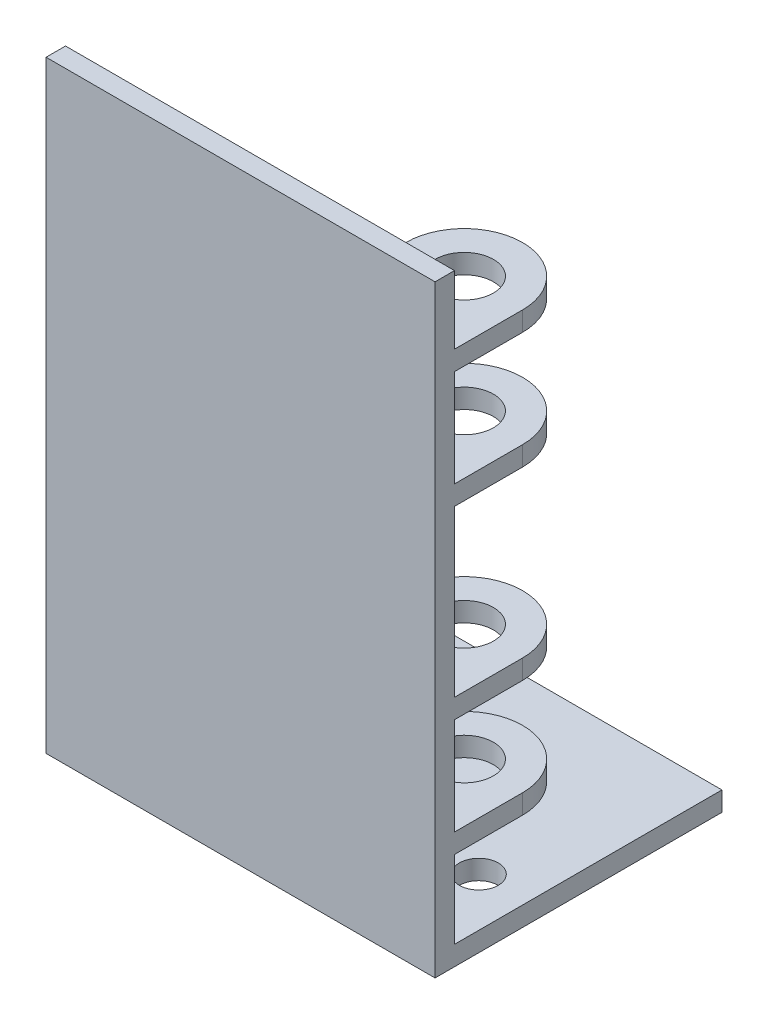
from build123d import *

# Parameters (mm, degrees)
CROQUIS2_W               = 40
CROQUIS2_H               = 55
CROQUIS2_R               = 2
SALIENTE_EXTRUIR1_DEPTH  = 2
CROQUIS3_W               = 40
CROQUIS3_H               = 2
SALIENTE_EXTRUIR2_DEPTH  = 42
CROQUIS4_R               = 3
SALIENTE_EXTRUIR3_DEPTH  = 2
MATRIZL1_COUNT           = 2
MATRIZL1_PITCH           = 12
CROQUIS6_W               = 40
CROQUIS6_H               = 27.5
CORTAR_EXTRUIR1_DEPTH    = 79.89866919
CROQUIS7_W               = 40
CROQUIS7_H               = 2
SALIENTE_EXTRUIR5_DEPTH  = 20
MATRIZL2_COPY_1_SKETCH_R = 3
MATRIZL2_COPY_1_DEPTH    = 2
MATRIZL2_COPY_2_SKETCH_R = 3
MATRIZL2_COPY_2_DEPTH    = 2


with BuildPart() as part:
    # Croquis2 → Saliente-Extruir1 (new body)
    with BuildSketch(Plane(origin=(0, 0, 0), x_dir=(1, 0, 0), z_dir=(0, 1, 0))):
        with Locations((20, 27.5)):
            Rectangle(CROQUIS2_W, CROQUIS2_H)
        with Locations(Location((5, 47.5, 0), (0, 0, 270))):
            Circle(CROQUIS2_R, mode=Mode.SUBTRACT)
        with Locations(Location((35, 47.5, 0), (0, 0, 270))):
            Circle(CROQUIS2_R, mode=Mode.SUBTRACT)
        with Locations(Location((35, 7.5, 0), (0, 0, 270))):
            Circle(CROQUIS2_R, mode=Mode.SUBTRACT)
        with Locations(Location((5, 7.5, 0), (0, 0, 270))):
            Circle(CROQUIS2_R, mode=Mode.SUBTRACT)
    extrude(amount=SALIENTE_EXTRUIR1_DEPTH)

    # Croquis3 → Saliente-Extruir2 (add)
    with BuildSketch(Plane(origin=(0, 0, 0), x_dir=(1, 0, 0), z_dir=(0, 1, 0))):
        with Locations((20, -1)):
            Rectangle(CROQUIS3_W, CROQUIS3_H)
    extrude(amount=SALIENTE_EXTRUIR2_DEPTH)

    # Croquis4 → Saliente-Extruir3 (add)
    with BuildSketch(Plane(origin=(0, 22, 0), x_dir=(1, 0, 0), z_dir=(0, 1, 0))):
        with BuildLine():
            Line((40, 7), (40, 0))
            Line((40, 0), (28, 0))
            Line((28, 0), (28, 7))
            ThreePointArc((28, 7), (34, 13), (40, 7))
        make_face()
        with Locations(Location((34, 7, 0), (0, 0, 270))):
            Circle(CROQUIS4_R, mode=Mode.SUBTRACT)
    saliente_extruir3 = extrude(amount=SALIENTE_EXTRUIR3_DEPTH)

    # MatrizL1: Saliente-Extruir3 ×2
    with Locations(*[(0, -i * MATRIZL1_PITCH, 0) for i in range(1, MATRIZL1_COUNT)]):
        add(saliente_extruir3)

    # Croquis6 → Cortar-Extruir1 (cut, through all)
    with BuildSketch(Plane(origin=(0, 2, 0), x_dir=(1, 0, 0), z_dir=(0, 1, 0))):
        with Locations((20, 41.25)):
            Rectangle(CROQUIS6_W, CROQUIS6_H)
    extrude(amount=-CORTAR_EXTRUIR1_DEPTH, mode=Mode.SUBTRACT)

    # Croquis7 → Saliente-Extruir5 (add)
    with BuildSketch(Plane(origin=(0, 42, 0), x_dir=(1, 0, 0), z_dir=(0, 1, 0))):
        with Locations((20, -1)):
            Rectangle(CROQUIS7_W, CROQUIS7_H)
    extrude(amount=SALIENTE_EXTRUIR5_DEPTH)

    # MatrizL2 copy 1 sketch → MatrizL2 copy 1 (add)
    with BuildSketch(Plane(origin=(0, 41, 0), x_dir=(1, 0, 0), z_dir=(0, 1, 0))):
        with BuildLine():
            Line((40, 7), (40, 0))
            Line((40, 0), (28, 0))
            Line((28, 0), (28, 7))
            ThreePointArc((28, 7), (34, 13), (40, 7))
        make_face()
        with Locations(Location((34, 7, 0), (0, 0, 270))):
            Circle(MATRIZL2_COPY_1_SKETCH_R, mode=Mode.SUBTRACT)
    extrude(amount=MATRIZL2_COPY_1_DEPTH)

    # MatrizL2 copy 2 sketch → MatrizL2 copy 2 (add)
    with BuildSketch(Plane(origin=(0, 53, 0), x_dir=(1, 0, 0), z_dir=(0, 1, 0))):
        with BuildLine():
            Line((40, 7), (40, 0))
            Line((40, 0), (28, 0))
            Line((28, 0), (28, 7))
            ThreePointArc((28, 7), (34, 13), (40, 7))
        make_face()
        with Locations(Location((34, 7, 0), (0, 0, 270))):
            Circle(MATRIZL2_COPY_2_SKETCH_R, mode=Mode.SUBTRACT)
    extrude(amount=MATRIZL2_COPY_2_DEPTH)


solid = part.part
